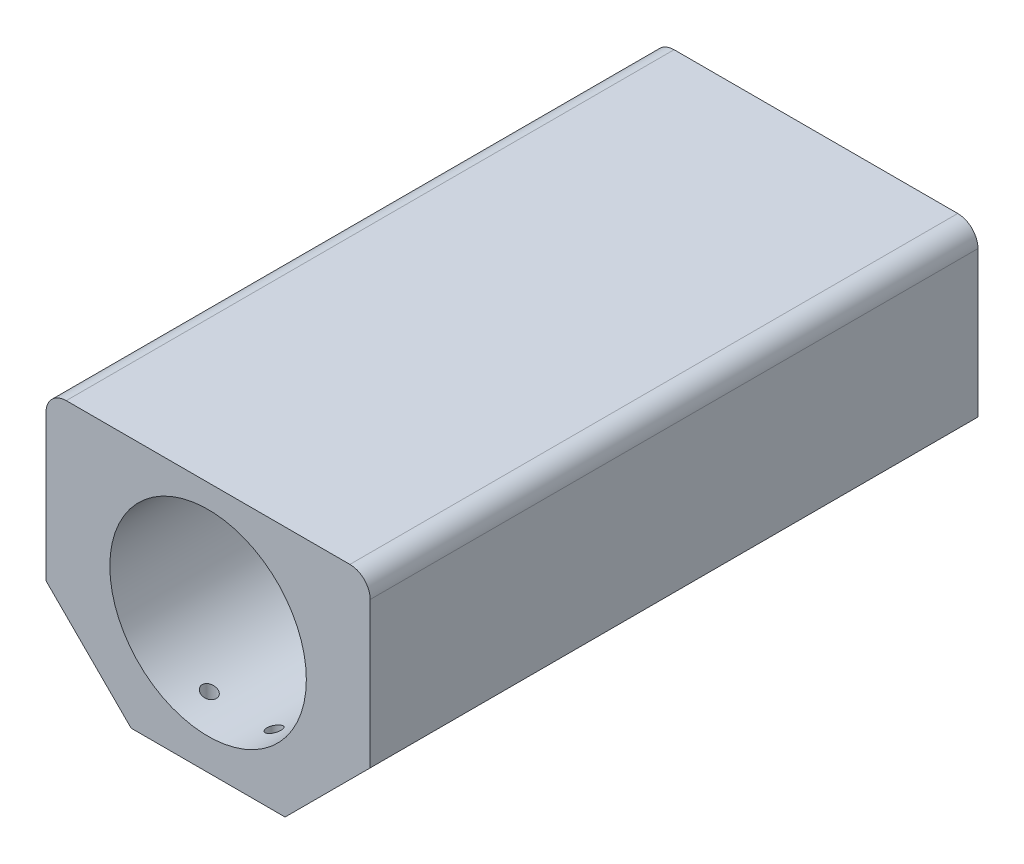
from build123d import *

# Parameters (mm, degrees)
SKETCH1_W               = 80
SKETCH1_H               = 60
SKETCH1_R               = 24.25
BOSS_EXTRUDE1_DEPTH     = 150
SKETCH2_W               = 80
SKETCH2_H               = 150
BOSS_EXTRUDE2_DEPTH     = 2
CUT_EXTRUDE1_DEPTH      = 159.505520409
SKETCH4_R               = 2.1
CUT_EXTRUDE2_DEPTH      = 24
CUT_EXTRUDE3_START      = -24
SKETCH5_R               = 2.1
CUT_EXTRUDE3_DEPTH      = 24
CUT_EXTRUDE4_REACH      = 169.165
CUT_EXTRUDE4_END_RADIUS = 24.25
SKETCH6_R               = 1.75
FILLET1_R               = 5


with BuildPart() as part:
    # Sketch1 → Boss-Extrude1 (new body)
    with BuildSketch(Plane.XY):
        Rectangle(SKETCH1_W, SKETCH1_H)
        Circle(SKETCH1_R, mode=Mode.SUBTRACT)
    extrude(amount=BOSS_EXTRUDE1_DEPTH)

    # Sketch2 → Boss-Extrude2 (add)
    with BuildSketch(Plane.XZ.offset(30)):
        with Locations((0, 75)):
            Rectangle(SKETCH2_W, SKETCH2_H)
    extrude(amount=BOSS_EXTRUDE2_DEPTH)

    # Sketch3 → Cut-Extrude1 (cut, through all)
    with BuildSketch(Plane.XY.offset(150)):
        Polygon((-40, -11), (-40, -32), (-19, -32), align=None)
        Polygon((19, -32), (40, -11), (40, -32), align=None)
    extrude(amount=-CUT_EXTRUDE1_DEPTH, mode=Mode.SUBTRACT)

    # Sketch4 → Cut-Extrude2 (cut)
    with BuildSketch(Plane(origin=(40, 0, 0), x_dir=(0, 0, -1), z_dir=(1, 0, 0))):
        with Locations(Location((-123, -29, 0), (0, 0, 90))):
            Circle(SKETCH4_R)
    extrude(amount=-CUT_EXTRUDE2_DEPTH, mode=Mode.SUBTRACT)

    # Sketch5 → Cut-Extrude3 (cut)
    with BuildSketch(Plane.ZY.offset(40).offset(CUT_EXTRUDE3_START)):
        with Locations(Location((123, -29, 0), (0, 0, 90))):
            Circle(SKETCH5_R)
    extrude(amount=CUT_EXTRUDE3_DEPTH, mode=Mode.SUBTRACT)

    # Cut-Extrude4: up to this cylinder (the profile starts outside it)
    cut_extrude4_end = Plane(origin=(0, 0, 126.7), z_dir=(0, 0, -1)) * Cylinder(CUT_EXTRUDE4_END_RADIUS, 417.83, mode=Mode.PRIVATE)
    # Sketch6 → Cut-Extrude4 (cut, up to the surface)
    with BuildSketch(Plane.XZ.offset(32), mode=Mode.PRIVATE) as cut_extrude4_sk1:
        with Locations(Location((-8, 141.7, 0), (0, 0, 270))):
            Circle(SKETCH6_R)
    cut_extrude4_tool1 = extrude(cut_extrude4_sk1.sketch, amount=-CUT_EXTRUDE4_REACH, mode=Mode.PRIVATE) - cut_extrude4_end
    add(cut_extrude4_tool1.solids().sort_by_distance((-8, -32, 141.7))[0], mode=Mode.SUBTRACT)
    # Sketch6 → Cut-Extrude4 (cut, up to the surface)
    with BuildSketch(Plane.XZ.offset(32), mode=Mode.PRIVATE) as cut_extrude4_sk2:
        with Locations(Location((-8, 111.7, 0), (0, 0, 270))):
            Circle(SKETCH6_R)
    cut_extrude4_tool2 = extrude(cut_extrude4_sk2.sketch, amount=-CUT_EXTRUDE4_REACH, mode=Mode.PRIVATE) - cut_extrude4_end
    add(cut_extrude4_tool2.solids().sort_by_distance((-8, -32, 111.7))[0], mode=Mode.SUBTRACT)
    # Sketch6 → Cut-Extrude4 (cut, up to the surface)
    with BuildSketch(Plane.XZ.offset(32), mode=Mode.PRIVATE) as cut_extrude4_sk3:
        with Locations(Location((8, 111.7, 0), (0, 0, 270))):
            Circle(SKETCH6_R)
    cut_extrude4_tool3 = extrude(cut_extrude4_sk3.sketch, amount=-CUT_EXTRUDE4_REACH, mode=Mode.PRIVATE) - cut_extrude4_end
    add(cut_extrude4_tool3.solids().sort_by_distance((8, -32, 111.7))[0], mode=Mode.SUBTRACT)
    # Sketch6 → Cut-Extrude4 (cut, up to the surface)
    with BuildSketch(Plane.XZ.offset(32), mode=Mode.PRIVATE) as cut_extrude4_sk4:
        with Locations(Location((8, 141.7, 0), (0, 0, 270))):
            Circle(SKETCH6_R)
    cut_extrude4_tool4 = extrude(cut_extrude4_sk4.sketch, amount=-CUT_EXTRUDE4_REACH, mode=Mode.PRIVATE) - cut_extrude4_end
    add(cut_extrude4_tool4.solids().sort_by_distance((8, -32, 141.7))[0], mode=Mode.SUBTRACT)

    # Fillet1
    fillet1_edges = [part.edges().sort_by_distance(p)[0] for p in [
        (-40, 30, 75),
        (40, 30, 75),
    ]]
    fillet(fillet1_edges, radius=FILLET1_R)


solid = part.part
